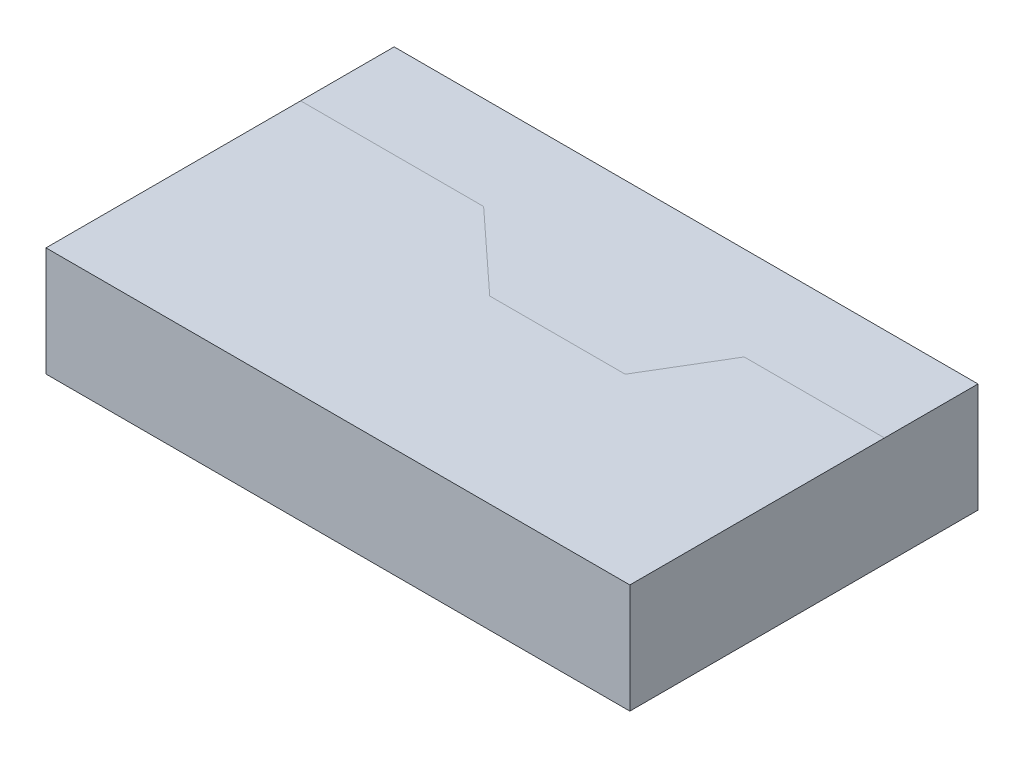
from build123d import *

# Parameters (mm, degrees)
SKETCH1_W      = 135.676166338
SKETCH1_H      = 80.901025057
EXTRUDE1_DEPTH = 25.4


with BuildPart() as part:
    # Sketch1 → Extrude1 (new body)
    with BuildSketch(Plane(origin=(0, 0, 0), x_dir=(1, 0, 0), z_dir=(0, 1, 0))):
        with Locations((67.838083169, 40.450512528)):
            Rectangle(SKETCH1_W, SKETCH1_H)
    extrude(amount=-EXTRUDE1_DEPTH)


solid = part.part
